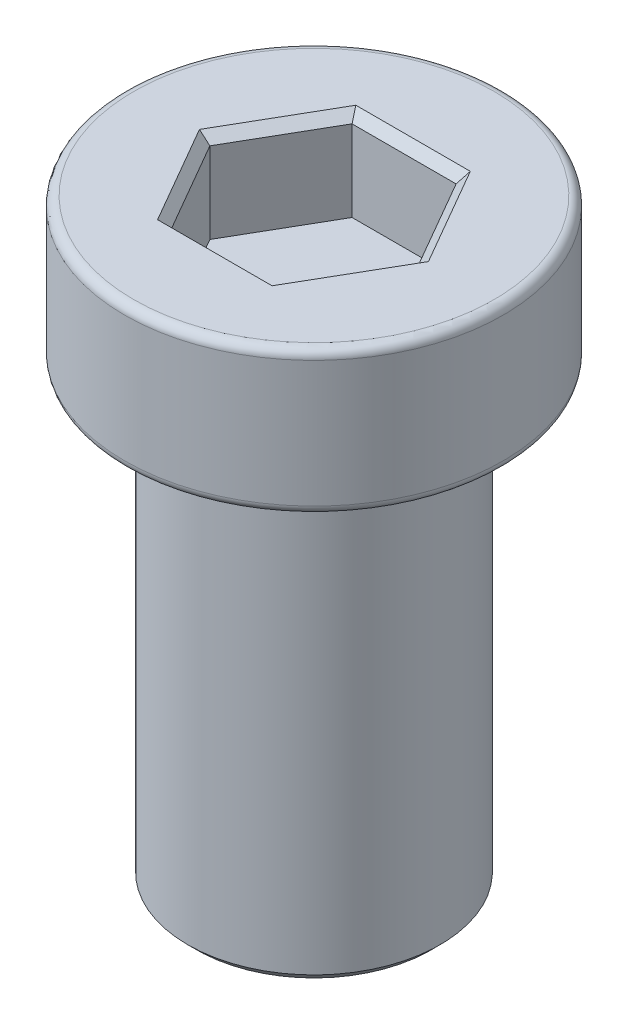
from build123d import *

# Parameters (mm, degrees)
SKETCH_1_R          = 10.5
EXTRUDE_1_DEPTH     = 8
SKETCH_2_R          = 7
EXTRUDE_2_DEPTH     = 25
CUT_EXTRUDE_1_DEPTH = 5
CHAMFER_1_SIZE      = 0.5
FILLET_1_R          = 0.5
CHAMFER_2_SIZE      = 0.5


with BuildPart() as part:
    # 草图1 → 凸台-拉伸1 (new body)
    with BuildSketch(Plane(origin=(0, 0, 0), x_dir=(1, 0, 0), z_dir=(0, 1, 0))):
        with Locations(Location((0, 0, 0), (0, 0, 270))):
            Circle(SKETCH_1_R)
    extrude(amount=EXTRUDE_1_DEPTH)

    # 草图2 → 凸台-拉伸2 (add)
    with BuildSketch(Plane.XZ):
        with Locations(Location((0, 0, 0), (0, 0, 270))):
            Circle(SKETCH_2_R)
    extrude(amount=EXTRUDE_2_DEPTH)

    # 草图3 → 切除-拉伸1 (cut)
    with BuildSketch(Plane(origin=(0, 8, 0), x_dir=(1, 0, 0), z_dir=(0, 1, 0))):
        Polygon((5.773502692, 0), (2.886751346, 5), (-2.886751346, 5), (-5.773502692, 0), (-2.886751346, -5), (2.886751346, -5), align=None)
    extrude(amount=-CUT_EXTRUDE_1_DEPTH, mode=Mode.SUBTRACT)

    # 倒角1
    chamfer_1_edges = [part.edges().sort_by_distance(p)[0] for p in [
        (0, -25, 7),
    ]]
    chamfer(chamfer_1_edges, length=CHAMFER_1_SIZE)

    # 圆角1
    fillet_1_edges = [part.edges().sort_by_distance(p)[0] for p in [
        (0, 0, -10.5),
        (0, 8, -10.5),
    ]]
    fillet(fillet_1_edges, radius=FILLET_1_R)

    # 倒角2
    chamfer_2_edges = [part.edges().sort_by_distance(p)[0] for p in [
        (4.330127019, 8, 2.5),
        (4.330127019, 8, -2.5),
        (0, 8, -5),
        (-4.330127019, 8, -2.5),
        (-4.330127019, 8, 2.5),
        (0, 8, 5),
    ]]
    chamfer(chamfer_2_edges, length=CHAMFER_2_SIZE)


solid = part.part
